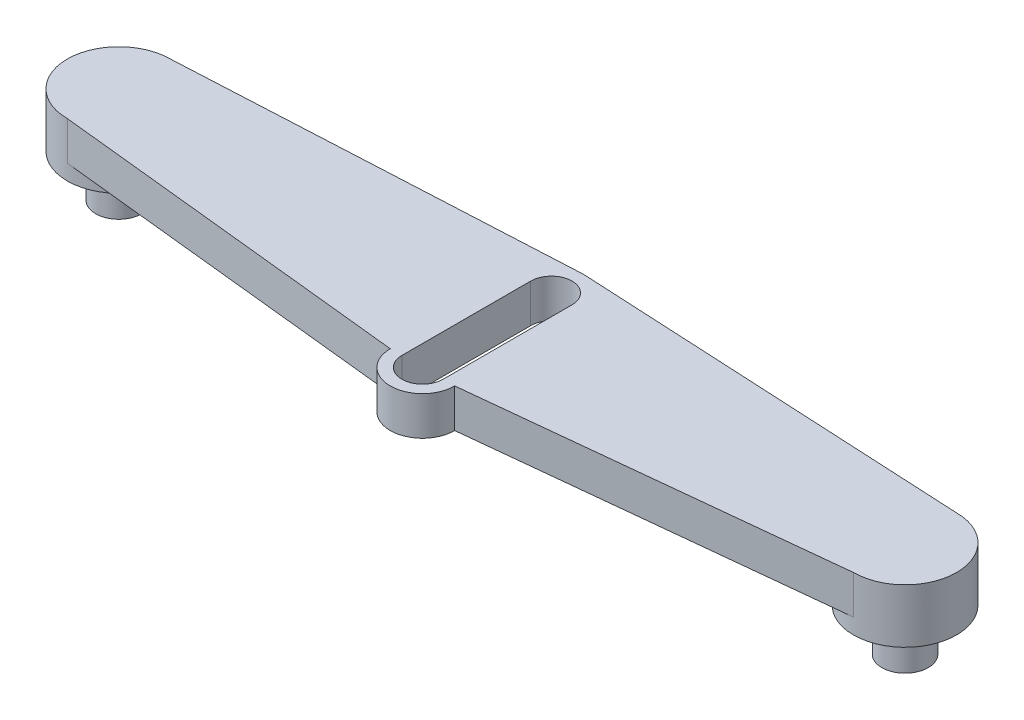
from build123d import *

# Parameters (mm, degrees)
BOSS_EXTRUDE1_DEPTH = 3
SKETCH1_3_R         = 1.8
BOSS_EXTRUDE2_DEPTH = 4.5
BOSS_EXTRUDE3_START = -1.2
SKETCH1_4_R         = 3.998679456
SKETCH1_4_R_2       = 2
SKETCH1_4_R_3       = 4.002518736
BOSS_EXTRUDE3_DEPTH = 1.2


with BuildPart() as part:
    # Sketch1 → Boss-Extrude1 (new body)
    with BuildSketch(Plane(origin=(0, 0, 0), x_dir=(1, 0, 0), z_dir=(0, 1, 0))):
        with BuildLine():
            Line((6.299371737, -15.895179228), (34.299371737, -18.834953384))
            ThreePointArc((34.299371737, -18.834953384), (36.799371737, -21.334953384), (39.299371737, -18.834953384))
            Line((39.299371737, -18.834953384), (67.302380501, -15.899018508))
            ThreePointArc((67.302380501, -15.899018508), (71.304899237, -11.896499772), (67.302380501, -7.893981036))
            Line((67.302380501, -7.893981036), (36.799371737, -6.334953384))
            Line((36.799371737, -6.334953384), (6.299371737, -7.897820316))
            ThreePointArc((6.299371737, -7.897820316), (2.300692281, -11.896499772), (6.299371737, -15.895179228))
        make_face()
        with BuildLine():
            ThreePointArc((35.199371737, -8.834953384), (36.799371737, -7.234953384), (38.399371737, -8.834953384))
            Line((38.399371737, -8.834953384), (38.399371737, -18.834953384))
            ThreePointArc((38.399371737, -18.834953384), (36.799371737, -20.434953384), (35.199371737, -18.834953384))
            Line((35.199371737, -18.834953384), (35.199371737, -8.834953384))
        make_face(mode=Mode.SUBTRACT)
    extrude(amount=BOSS_EXTRUDE1_DEPTH)

    # Sketch1<3> → Boss-Extrude2 (add)
    with BuildSketch(Plane(origin=(0, 0, 0), x_dir=(1, 0, 0), z_dir=(0, 1, 0))):
        with Locations((67.302380501, -11.896499772)):
            Circle(SKETCH1_3_R)
        with Locations((6.299371737, -11.896499772)):
            Circle(SKETCH1_3_R)
    extrude(amount=-BOSS_EXTRUDE2_DEPTH)

    # Sketch1<4> → Boss-Extrude3 (add)
    # profile 1 of 2: a face of its own
    with BuildSketch(Plane(origin=(0, 0, 0), x_dir=(1, 0, 0), z_dir=(0, 1, 0)).offset(BOSS_EXTRUDE3_START)):
        with Locations((6.299371737, -11.896499772)):
            Circle(SKETCH1_4_R)
        with Locations((6.299371737, -11.896499772)):
            Circle(SKETCH1_4_R_2, mode=Mode.SUBTRACT)
    # profile 2 of 2: a face of its own
    with BuildSketch(Plane(origin=(0, 0, 0), x_dir=(1, 0, 0), z_dir=(0, 1, 0)).offset(BOSS_EXTRUDE3_START)):
        with Locations((67.302380501, -11.896499772)):
            Circle(SKETCH1_4_R_3)
        with Locations((67.302380501, -11.896499772)):
            Circle(SKETCH1_4_R_2, mode=Mode.SUBTRACT)
    extrude(amount=BOSS_EXTRUDE3_DEPTH)


solid = part.part
